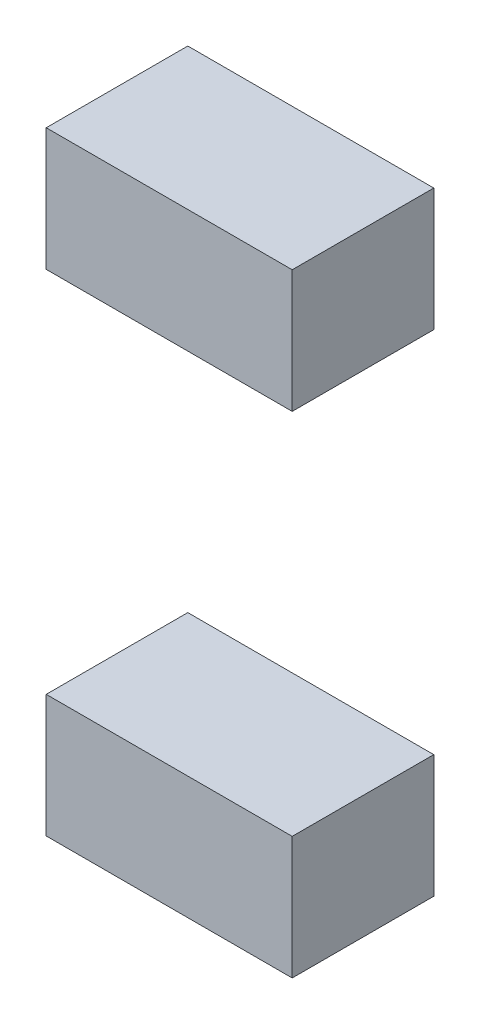
from build123d import *

# Parameters (mm, degrees)
SKETCH1_W           = 100.260802056
SKETCH1_H           = 57.701114652
BOSS_EXTRUDE1_DEPTH = 50
SKETCH2_W           = 100.260802056
SKETCH2_H           = 57.701114652
BOSS_EXTRUDE2_DEPTH = 50


with BuildPart() as part:
    # Sketch1 → Boss-Extrude1 (new body)
    with BuildSketch(Plane(origin=(0, 0, 0), x_dir=(1, 0, 0), z_dir=(0, 1, 0))):
        with Locations((-2.250752699, -4.910733162)):
            Rectangle(SKETCH1_W, SKETCH1_H)
    extrude(amount=BOSS_EXTRUDE1_DEPTH)


with BuildPart() as body_2:
    # Sketch2 → Boss-Extrude2 (new body)
    with BuildSketch(Plane(origin=(0, 200, 0), x_dir=(1, 0, 0), z_dir=(0, 1, 0))):
        with Locations((-2.250752699, -4.910733162)):
            Rectangle(SKETCH2_W, SKETCH2_H)
    extrude(amount=BOSS_EXTRUDE2_DEPTH)


solid = Compound([part.part, body_2.part])
